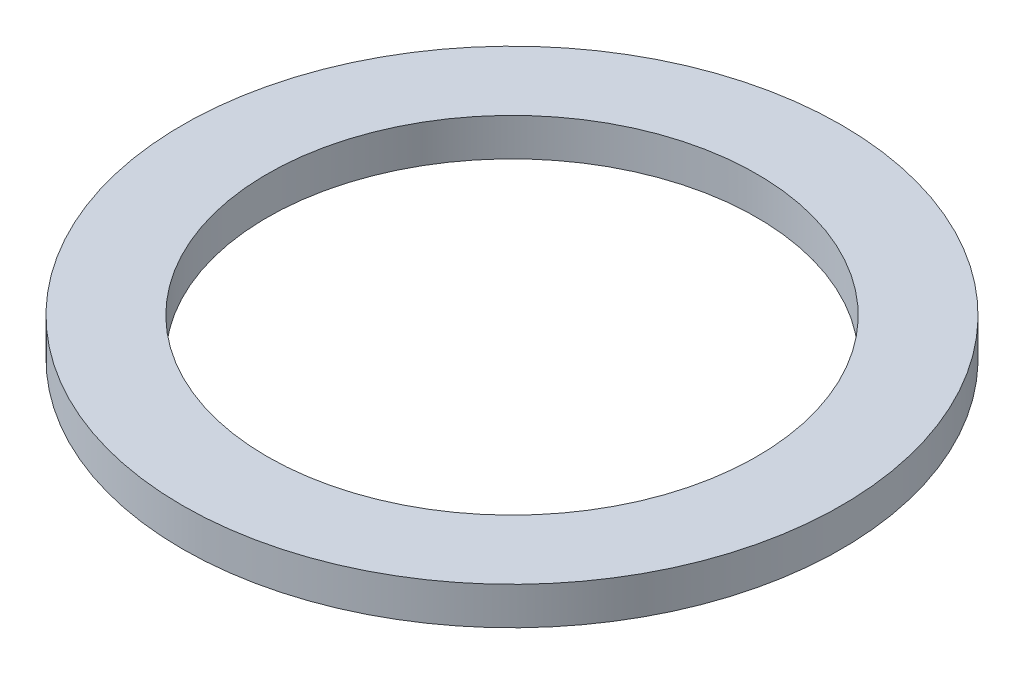
from build123d import *

# Parameters (mm, degrees)
SKETCH1_R           = 7
SKETCH1_R_2         = 5.2
BOSS_EXTRUDE1_DEPTH = 0.8


with BuildPart() as part:
    # Sketch1 → Boss-Extrude1 (new body)
    with BuildSketch(Plane(origin=(0, 0, 0), x_dir=(1, 0, 0), z_dir=(0, 1, 0))):
        with Locations(Location((0, 0, 0), (0, 0, 270))):
            Circle(SKETCH1_R)
        with Locations(Location((0, 0, 0), (0, 0, 270))):
            Circle(SKETCH1_R_2, mode=Mode.SUBTRACT)
    extrude(amount=BOSS_EXTRUDE1_DEPTH)


solid = part.part
